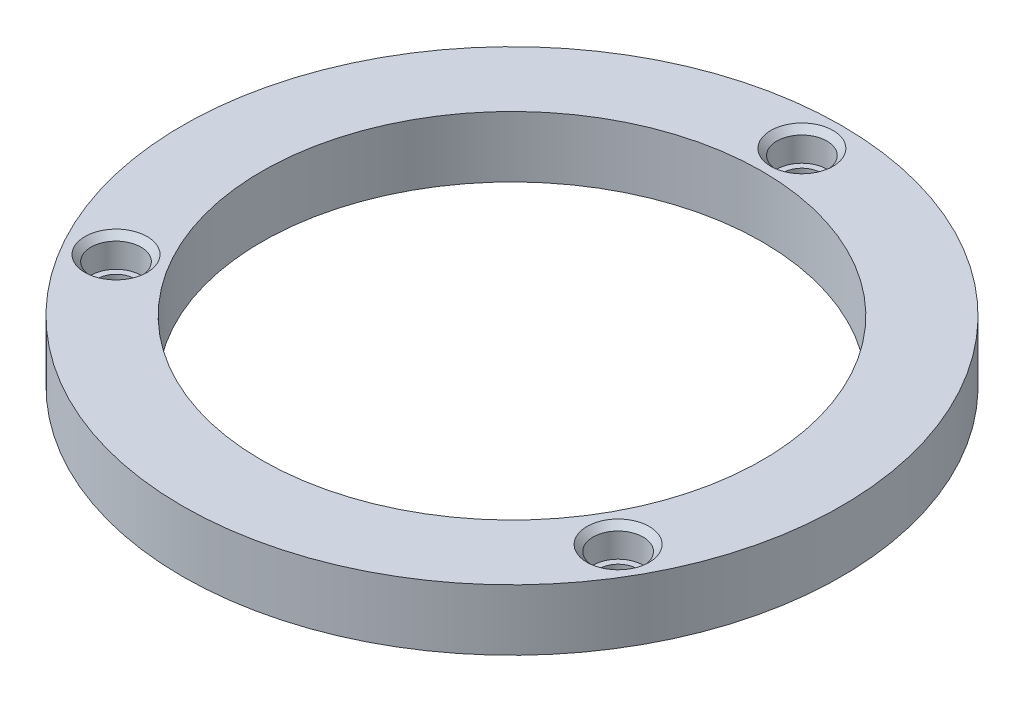
from build123d import *

# Parameters (mm, degrees)
SKETCH1_R           = 54
SKETCH1_R_2         = 41
BOSS_EXTRUDE1_DEPTH = 10
SKETCH2_R           = 4.1
CUT_EXTRUDE1_DEPTH  = 5
CUT_EXTRUDE2_REACH  = 78.531
SKETCH3_R           = 3.1
CHAMFER1_SIZE       = 1


with BuildPart() as part:
    # Sketch1 → Boss-Extrude1 (new body)
    with BuildSketch(Plane(origin=(0, 0, 0), x_dir=(1, 0, 0), z_dir=(0, 1, 0))):
        with Locations(Location((0, 0, 0), (0, 0, 270))):
            Circle(SKETCH1_R)
        with Locations(Location((0, 0, 0), (0, 0, 270))):
            Circle(SKETCH1_R_2, mode=Mode.SUBTRACT)
    extrude(amount=BOSS_EXTRUDE1_DEPTH)

    # Sketch2 → Cut-Extrude1 (cut)
    with BuildSketch(Plane(origin=(0, 10, 0), x_dir=(1, 0, 0), z_dir=(0, 1, 0))):
        with Locations(Location((0, 47.5, 0), (0, 0, 270))):
            Circle(SKETCH2_R)
        with Locations(Location((41.13620668, -23.75, 0), (0, 0, 270))):
            Circle(SKETCH2_R)
        with Locations(Location((-41.13620668, -23.75, 0), (0, 0, 270))):
            Circle(SKETCH2_R)
    extrude(amount=-CUT_EXTRUDE1_DEPTH, mode=Mode.SUBTRACT)

    # Sketch3 → Cut-Extrude2 (cut, up to next)
    with BuildSketch(Plane(origin=(0, 5, 0), x_dir=(1, 0, 0), z_dir=(0, 1, 0)), mode=Mode.PRIVATE) as cut_extrude2_sk1:
        with Locations(Location((0, 47.5, 0), (0, 0, 270))):
            Circle(SKETCH3_R)
    cut_extrude2_tool1 = extrude(cut_extrude2_sk1.sketch, amount=-CUT_EXTRUDE2_REACH, mode=Mode.PRIVATE) & part.part
    # Sketch3 → Cut-Extrude2 (cut, up to next)
    with BuildSketch(Plane(origin=(0, 5, 0), x_dir=(1, 0, 0), z_dir=(0, 1, 0)), mode=Mode.PRIVATE) as cut_extrude2_sk2:
        with Locations(Location((41.13620668, -23.75, 0), (0, 0, 270))):
            Circle(SKETCH3_R)
    cut_extrude2_tool2 = extrude(cut_extrude2_sk2.sketch, amount=-CUT_EXTRUDE2_REACH, mode=Mode.PRIVATE) & part.part
    # Sketch3 → Cut-Extrude2 (cut, up to next)
    with BuildSketch(Plane(origin=(0, 5, 0), x_dir=(1, 0, 0), z_dir=(0, 1, 0)), mode=Mode.PRIVATE) as cut_extrude2_sk3:
        with Locations(Location((-41.13620668, -23.75, 0), (0, 0, 270))):
            Circle(SKETCH3_R)
    cut_extrude2_tool3 = extrude(cut_extrude2_sk3.sketch, amount=-CUT_EXTRUDE2_REACH, mode=Mode.PRIVATE) & part.part
    add(cut_extrude2_tool1.solids().sort_by_distance((0, 5, -47.5))[0], mode=Mode.SUBTRACT)
    add(cut_extrude2_tool2.solids().sort_by_distance((41.136207, 5, 23.75))[0], mode=Mode.SUBTRACT)
    add(cut_extrude2_tool3.solids().sort_by_distance((-41.136207, 5, 23.75))[0], mode=Mode.SUBTRACT)

    # Chamfer1
    chamfer1_edges = [part.edges().sort_by_distance(p)[0] for p in [
        (0, 10, -51.6),
        (41.13620668, 10, 19.65),
        (-41.13620668, 10, 19.65),
    ]]
    chamfer(chamfer1_edges, length=CHAMFER1_SIZE)


solid = part.part
